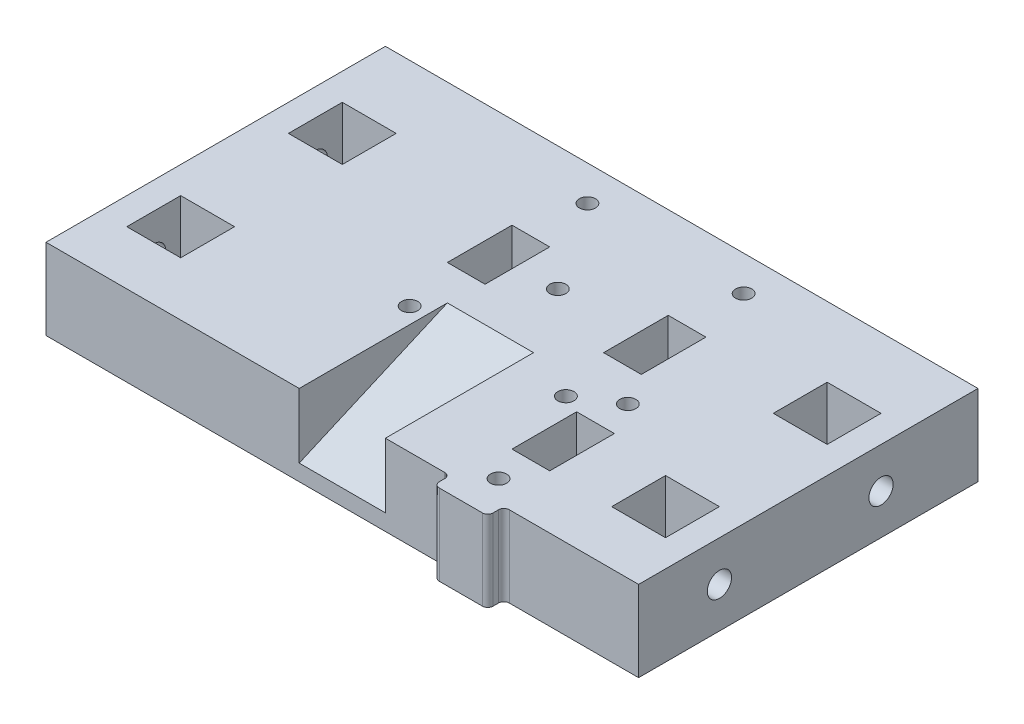
from build123d import *

# Parameters (mm, degrees)
CROQUIS1_W              = 80
CROQUIS1_H              = 60
CROQUIS1_R              = 1.5
CROQUIS1_W_2            = 7
CROQUIS1_H_2            = 25
CROQUIS1_W_3            = 10
CROQUIS1_H_3            = 20
CROQUIS1_H_4            = 10
CROQUIS1_W_4            = 5
CROQUIS1_H_5            = 6.5
SALIENTE_EXTRUIR1_DEPTH = 15
CORTAR_EXTRUIR1_DEPTH   = 10
CROQUIS3_R              = 1.5
CORTAR_EXTRUIR2_DEPTH   = 25
CORTAR_EXTRUIR3_START   = -25
CROQUIS6_R              = 1.5
CORTAR_EXTRUIR3_DEPTH   = 25
CROQUIS8_W              = 15
CROQUIS8_H              = 17.838651154
CROQUIS8_R              = 1.5
SALIENTE_EXTRUIR2_DEPTH = 5
CORTAR_EXTRUIR4_START   = -55
CORTAR_EXTRUIR4_DEPTH   = 8
CROQUIS10_R             = 1.5
CROQUIS10_W             = 7
CROQUIS10_H             = 12
CORTAR_EXTRUIR5_DEPTH   = 16
CROQUIS12_W             = 110
CROQUIS12_H             = 15
SALIENTE_EXTRUIR3_DEPTH = 3
CORTAR_EXTRUIR6_DEPTH   = 10
SALIENTE_EXTRUIR4_DEPTH = 15
CROQUIS15_R             = 2.25
CORTAR_EXTRUIR7_DEPTH   = 10
CORTAR_EXTRUIR8_START   = -10
CROQUIS16_R             = 2.25
CORTAR_EXTRUIR8_DEPTH   = 10


with BuildPart() as part:
    # Croquis1 → Saliente-Extruir1 (new body)
    # profile 1 of 13: a face of its own
    with BuildSketch(Plane(origin=(0, 0, 0), x_dir=(1, 0, 0), z_dir=(0, 1, 0))):
        with Locations((0, -10)):
            Rectangle(CROQUIS1_W, CROQUIS1_H)
        with Locations(Location((18, -16.5, 0), (0, 0, 270))):
            Circle(CROQUIS1_R, mode=Mode.SUBTRACT)
        with Locations(Location((-11, -16.5, 0), (0, 0, 270))):
            Circle(CROQUIS1_R, mode=Mode.SUBTRACT)
        with Locations(Location((18, 16.5, 0), (0, 0, 270))):
            Circle(CROQUIS1_R, mode=Mode.SUBTRACT)
        with Locations(Location((-11, 16.5, 0), (0, 0, 270))):
            Circle(CROQUIS1_R, mode=Mode.SUBTRACT)
        with Locations((18, 0)):
            Rectangle(CROQUIS1_W_2, CROQUIS1_H_2, mode=Mode.SUBTRACT)
        Polygon((6.711696879, 3.875), (0, 7.75), (-6.711696879, 3.875), (-6.711696879, -3.875), (0, -7.75), (6.711696879, -3.875), align=None, mode=Mode.SUBTRACT)
        with Locations((-11, 0)):
            Rectangle(CROQUIS1_W_2, CROQUIS1_H_2, mode=Mode.SUBTRACT)
    # profile 2 of 13: a face of its own
    with BuildSketch(Plane(origin=(0, 0, 0), x_dir=(1, 0, 0), z_dir=(0, 1, 0))):
        with Locations((-45, -10)):
            Rectangle(CROQUIS1_W_3, CROQUIS1_H_3)
    # profile 3 of 13: a face of its own
    with BuildSketch(Plane(origin=(0, 0, 0), x_dir=(1, 0, 0), z_dir=(0, 1, 0))):
        with Locations((-45, -35)):
            Rectangle(CROQUIS1_W_3, CROQUIS1_H_4)
    # profile 4 of 13: a face of its own
    with BuildSketch(Plane(origin=(0, 0, 0), x_dir=(1, 0, 0), z_dir=(0, 1, 0))):
        with Locations((-52.5, -10)):
            Rectangle(CROQUIS1_W_4, CROQUIS1_H)
    # profile 5 of 13: a face of its own
    with BuildSketch(Plane(origin=(0, 0, 0), x_dir=(1, 0, 0), z_dir=(0, 1, 0))):
        with Locations((-45, 15)):
            Rectangle(CROQUIS1_W_3, CROQUIS1_H_4)
    # profile 6 of 13: a face of its own
    with BuildSketch(Plane(origin=(0, 0, 0), x_dir=(1, 0, 0), z_dir=(0, 1, 0))):
        with Locations((45, 15)):
            Rectangle(CROQUIS1_W_3, CROQUIS1_H_4)
    # profile 7 of 13: a face of its own
    with BuildSketch(Plane(origin=(0, 0, 0), x_dir=(1, 0, 0), z_dir=(0, 1, 0))):
        with Locations((52.5, -10)):
            Rectangle(CROQUIS1_W_4, CROQUIS1_H)
    # profile 8 of 13: a face of its own
    with BuildSketch(Plane(origin=(0, 0, 0), x_dir=(1, 0, 0), z_dir=(0, 1, 0))):
        with Locations((45, -10)):
            Rectangle(CROQUIS1_W_3, CROQUIS1_H_3)
    # profile 9 of 13: a face of its own
    with BuildSketch(Plane(origin=(0, 0, 0), x_dir=(1, 0, 0), z_dir=(0, 1, 0))):
        with Locations((45, -35)):
            Rectangle(CROQUIS1_W_3, CROQUIS1_H_4)
    # profile 10 of 13: a face of its own
    with BuildSketch(Plane(origin=(0, 0, 0), x_dir=(1, 0, 0), z_dir=(0, 1, 0))):
        with Locations((-11, 9.25)):
            Rectangle(CROQUIS1_W_2, CROQUIS1_H_5)
    # profile 11 of 13: a face of its own
    with BuildSketch(Plane(origin=(0, 0, 0), x_dir=(1, 0, 0), z_dir=(0, 1, 0))):
        with Locations((-11, -9.25)):
            Rectangle(CROQUIS1_W_2, CROQUIS1_H_5)
    # profile 12 of 13: a face of its own
    with BuildSketch(Plane(origin=(0, 0, 0), x_dir=(1, 0, 0), z_dir=(0, 1, 0))):
        with Locations((18, 9.25)):
            Rectangle(CROQUIS1_W_2, CROQUIS1_H_5)
    # profile 13 of 13: a face of its own
    with BuildSketch(Plane(origin=(0, 0, 0), x_dir=(1, 0, 0), z_dir=(0, 1, 0))):
        with Locations((18, -9.25)):
            Rectangle(CROQUIS1_W_2, CROQUIS1_H_5)
    extrude(amount=SALIENTE_EXTRUIR1_DEPTH)

    # Croquis2 → Cortar-Extruir1 (cut)
    with BuildSketch(Plane.XZ):
        Polygon((-7.391560818, 16.5), (-9.195780409, 19.625), (-12.804219591, 19.625), (-14.608439182, 16.5), (-12.804219591, 13.375), (-9.195780409, 13.375), align=None)
        Polygon((21.608439182, 16.5), (19.804219591, 19.625), (16.195780409, 19.625), (14.391560818, 16.5), (16.195780409, 13.375), (19.804219591, 13.375), align=None)
        Polygon((-7.391560818, -16.5), (-9.195780409, -13.375), (-12.804219591, -13.375), (-14.608439182, -16.5), (-12.804219591, -19.625), (-9.195780409, -19.625), align=None)
        Polygon((21.608439182, -16.5), (19.804219591, -13.375), (16.195780409, -13.375), (14.391560818, -16.5), (16.195780409, -19.625), (19.804219591, -19.625), align=None)
    extrude(amount=-CORTAR_EXTRUIR1_DEPTH, mode=Mode.SUBTRACT)

    # Croquis3 → Cortar-Extruir2 (cut)
    with BuildSketch(Plane(origin=(55, 0, 0), x_dir=(0, 0, -1), z_dir=(1, 0, 0))):
        with Locations((-25, 7.5)):
            Circle(CROQUIS3_R)
        with Locations((5, 7.5)):
            Circle(CROQUIS3_R)
    extrude(amount=-CORTAR_EXTRUIR2_DEPTH, mode=Mode.SUBTRACT)

    # Croquis6 → Cortar-Extruir3 (cut)
    with BuildSketch(Plane.ZY.offset(55).offset(CORTAR_EXTRUIR3_START)):
        with Locations(Location((-5, 7.5, 0), (0, 0, 180))):
            Circle(CROQUIS6_R)
        with Locations(Location((25, 7.5, 0), (0, 0, 180))):
            Circle(CROQUIS6_R)
    extrude(amount=CORTAR_EXTRUIR3_DEPTH, mode=Mode.SUBTRACT)

    # Croquis8 → Saliente-Extruir2 (add)
    with BuildSketch(Plane(origin=(0, 15, 0), x_dir=(1, 0, 0), z_dir=(0, 1, 0))):
        Rectangle(CROQUIS8_W, CROQUIS8_H)
        with Locations(Location((0, 0, 0), (0, 0, 270))):
            Circle(CROQUIS8_R, mode=Mode.SUBTRACT)
    extrude(amount=-SALIENTE_EXTRUIR2_DEPTH)

    # Croquis9 → Cortar-Extruir4 (cut, symmetric)
    with BuildSketch(Plane(origin=(55, 0, 0), x_dir=(0, 0, -1), z_dir=(1, 0, 0)).offset(CORTAR_EXTRUIR4_START)):
        Polygon((-40, 3), (-12.5, 15), (-40, 15), align=None)
    extrude(amount=CORTAR_EXTRUIR4_DEPTH, both=True, mode=Mode.SUBTRACT)

    # Croquis10 → Cortar-Extruir5 (cut)
    with BuildSketch(Plane(origin=(0, 15, 0), x_dir=(1, 0, 0), z_dir=(0, 1, 0))):
        with Locations(Location((25, -12, 0), (0, 0, 270))):
            Circle(CROQUIS10_R)
        with Locations(Location((25, -36, 0), (0, 0, 270))):
            Circle(CROQUIS10_R)
        with Locations((25, -24)):
            Rectangle(CROQUIS10_W, CROQUIS10_H)
    extrude(amount=-CORTAR_EXTRUIR5_DEPTH, mode=Mode.SUBTRACT)

    # Croquis12 → Saliente-Extruir3 (add)
    with BuildSketch(Plane(origin=(0, 0, -20), x_dir=(-1, 0, 0), z_dir=(0, 0, -1))):
        with Locations((0, 7.5)):
            Rectangle(CROQUIS12_W, CROQUIS12_H)
    extrude(amount=SALIENTE_EXTRUIR3_DEPTH)

    # Croquis13 → Cortar-Extruir6 (cut)
    with BuildSketch(Plane.XZ):
        Polygon((28.608439182, 12), (26.804219591, 15.125), (23.195780409, 15.125), (21.391560818, 12), (23.195780409, 8.875), (26.804219591, 8.875), align=None)
        Polygon((28.608439182, 36), (26.804219591, 39.125), (23.195780409, 39.125), (21.391560818, 36), (23.195780409, 32.875), (26.804219591, 32.875), align=None)
    extrude(amount=-CORTAR_EXTRUIR6_DEPTH, mode=Mode.SUBTRACT)

    # Croquis14 → Saliente-Extruir4 (add)
    with BuildSketch(Plane.XZ):
        with BuildLine():
            Line((30, 41), (30, 42))
            ThreePointArc((30, 42), (29.707106781, 42.707106781), (29, 43))
            Line((29, 43), (21, 43))
            ThreePointArc((21, 43), (20.292893219, 42.707106781), (20, 42))
            Line((20, 42), (20, 41))
            ThreePointArc((20, 41), (19.707106781, 40.292893219), (19, 40))
            Line((19, 40), (31, 40))
            ThreePointArc((31, 40), (30.292893219, 40.292893219), (30, 41))
        make_face()
    extrude(amount=-SALIENTE_EXTRUIR4_DEPTH)

    # Croquis15 → Cortar-Extruir7 (cut)
    with BuildSketch(Plane(origin=(55, 0, 0), x_dir=(0, 0, -1), z_dir=(1, 0, 0))):
        with Locations((-25, 7.5)):
            Circle(CROQUIS15_R)
        with Locations((5, 7.5)):
            Circle(CROQUIS15_R)
    extrude(amount=-CORTAR_EXTRUIR7_DEPTH, mode=Mode.SUBTRACT)

    # Croquis16 → Cortar-Extruir8 (cut)
    with BuildSketch(Plane.ZY.offset(55).offset(CORTAR_EXTRUIR8_START)):
        with Locations(Location((-5, 7.5, 0), (0, 0, 180))):
            Circle(CROQUIS16_R)
        with Locations(Location((25, 7.5, 0), (0, 0, 180))):
            Circle(CROQUIS16_R)
    extrude(amount=CORTAR_EXTRUIR8_DEPTH, mode=Mode.SUBTRACT)


solid = part.part
